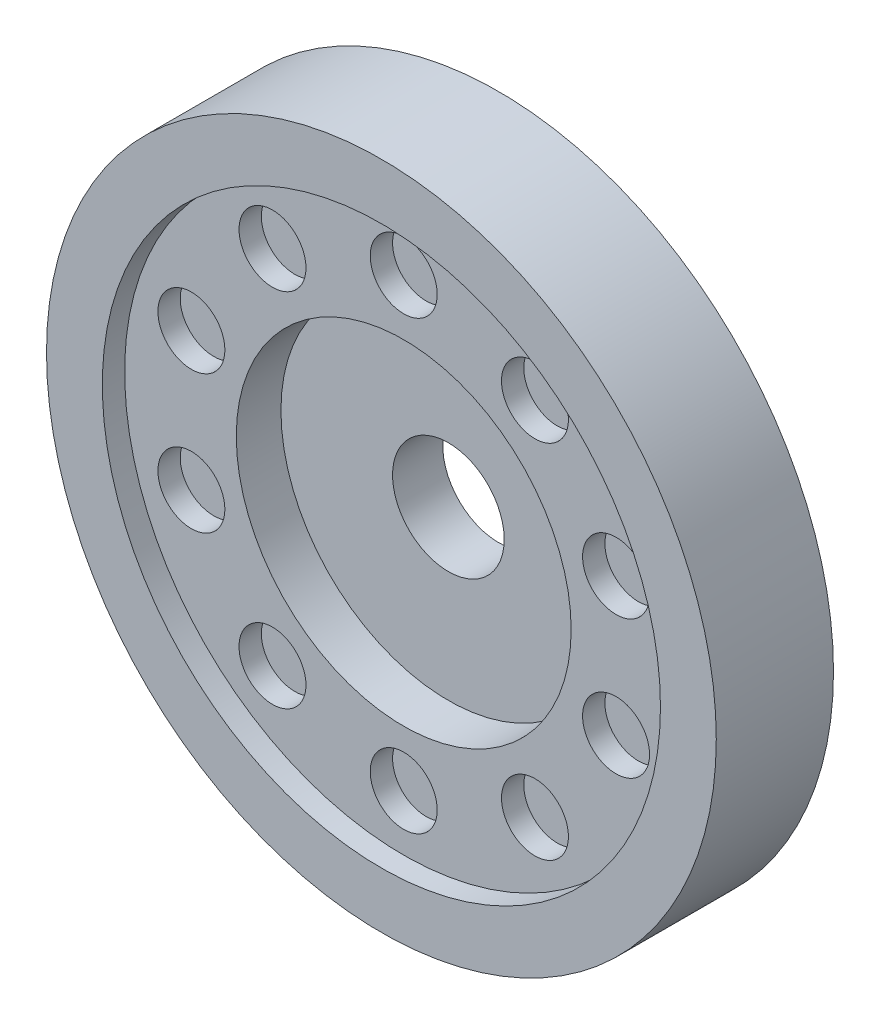
from build123d import *

# Parameters (mm, degrees)
SKETCH2_R           = 381
BOSS_EXTRUDE1_DEPTH = 133.35
SKETCH3_R           = 317.5
CUT_EXTRUDE1_DEPTH  = 25.4
SKETCH4_R           = 38.1
CUT_EXTRUDE2_DEPTH  = 25.4
SKETCH5_R           = 190.5
CUT_EXTRUDE3_DEPTH  = 50.8
SKETCH6_R           = 63.5
CUT_EXTRUDE4_DEPTH  = 545.176846255


with BuildPart() as part:
    # Sketch2 → Boss-Extrude1 (new body)
    with BuildSketch(Plane.XY):
        Circle(SKETCH2_R)
    extrude(amount=BOSS_EXTRUDE1_DEPTH)

    # Sketch3 → Cut-Extrude1 (cut)
    with BuildSketch(Plane.XY.offset(133.35)):
        Circle(SKETCH3_R)
    extrude(amount=-CUT_EXTRUDE1_DEPTH, mode=Mode.SUBTRACT)

    # Sketch4 → Cut-Extrude2 (cut)
    with BuildSketch(Plane.XY.offset(107.95)):
        with Locations((0, 254)):
            Circle(SKETCH4_R)
        with Locations((149.297454082, 205.490316571)):
            Circle(SKETCH4_R)
        with Locations((241.568355139, 78.490316571)):
            Circle(SKETCH4_R)
        with Locations((241.568355139, -78.490316571)):
            Circle(SKETCH4_R)
        with Locations((149.297454082, -205.490316571)):
            Circle(SKETCH4_R)
        with Locations((0, -254)):
            Circle(SKETCH4_R)
        with Locations((-149.297454082, -205.490316571)):
            Circle(SKETCH4_R)
        with Locations((-241.568355139, -78.490316571)):
            Circle(SKETCH4_R)
        with Locations((-241.568355139, 78.490316571)):
            Circle(SKETCH4_R)
        with Locations((-149.297454082, 205.490316571)):
            Circle(SKETCH4_R)
    extrude(amount=-CUT_EXTRUDE2_DEPTH, mode=Mode.SUBTRACT)

    # Sketch5 → Cut-Extrude3 (cut)
    with BuildSketch(Plane.XY.offset(107.95)):
        Circle(SKETCH5_R)
    extrude(amount=-CUT_EXTRUDE3_DEPTH, mode=Mode.SUBTRACT)

    # Sketch6 → Cut-Extrude4 (cut, through all)
    with BuildSketch(Plane.XY.offset(57.15)):
        Circle(SKETCH6_R)
    extrude(amount=-CUT_EXTRUDE4_DEPTH, mode=Mode.SUBTRACT)


solid = part.part
